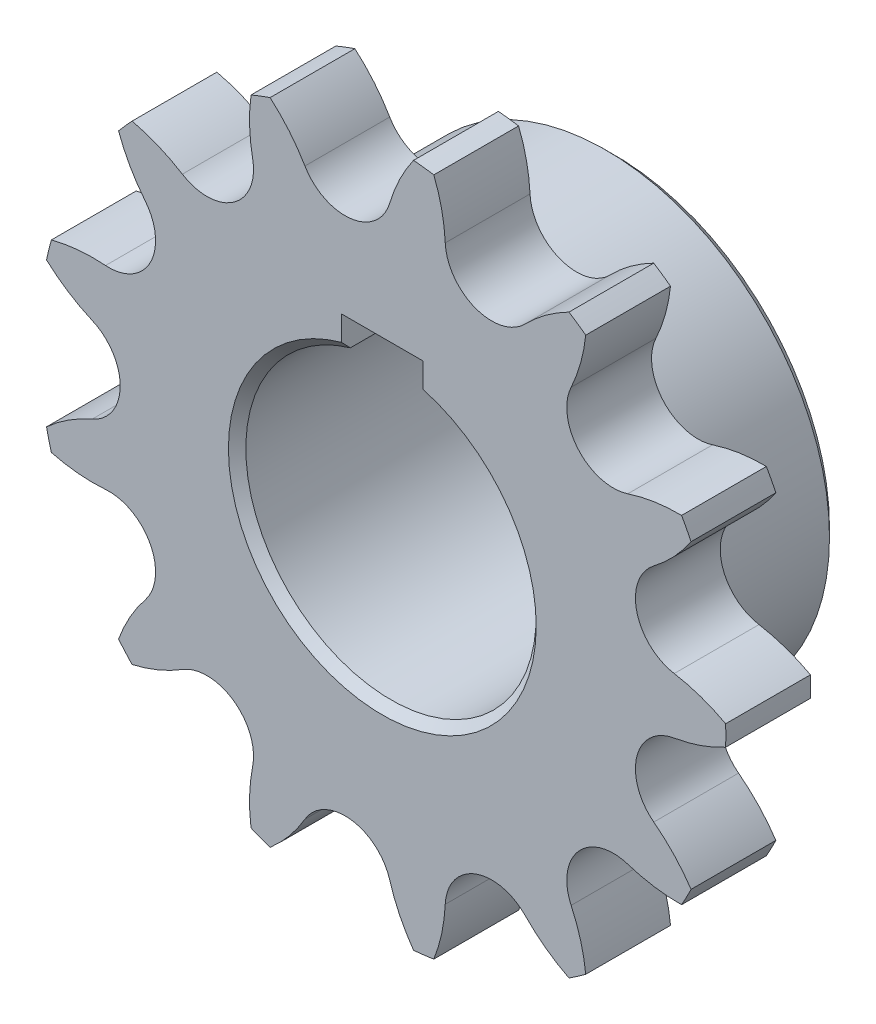
from build123d import *

# Parameters (mm, degrees)
SKETCH2_R           = 25
BOSS_EXTRUDE1_DEPTH = 14.6
BOSS_EXTRUDE2_START = -40
SKETCH3_R           = 38.5
SKETCH3_R_2         = 25
BOSS_EXTRUDE2_DEPTH = 40
SKETCH4_W           = 14
SKETCH4_H           = 9
CUT_EXTRUDE1_DEPTH  = 45
MOVE_FACE1_BY       = 0.3
CHAMFER3_SIZE       = 1.5
CHAMFER4_SIZE       = 3


with BuildPart() as part:
    # Sketch2 → Boss-Extrude1 (new body)
    with BuildSketch(Plane.XY):
        with BuildLine():
            ThreePointArc((53.163386549, 25.920934205), (52.371116098, 27.486482097), (51.532756355, 29.027840461))
            ThreePointArc((51.532756355, 29.027840461), (46.843166468, 28.705871605), (42.269756881, 27.619666278))
            ThreePointArc((42.269756881, 27.619666278), (33.778781557, 29.925389145), (32.513343984, 38.632379879))
            ThreePointArc((32.513343984, 38.632379879), (34.14289326, 43.041516576), (35.027782197, 47.658105016))
            ThreePointArc((35.027782197, 47.658105016), (33.598715171, 48.676142393), (32.140079536, 49.651342246))
            ThreePointArc((32.140079536, 49.651342246), (28.137280301, 47.186891894), (24.59251201, 44.099735432))
            ThreePointArc((24.59251201, 44.099735432), (16.002603901, 42.195398652), (10.835774224, 49.316977899))
            ThreePointArc((10.835774224, 49.316977899), (10.229640458, 53.978363864), (8.867735075, 58.47737831))
            ThreePointArc((8.867735075, 58.47737831), (7.129253506, 58.714685078), (5.384497826, 58.900319885))
            ThreePointArc((5.384497826, 58.900319885), (2.985482308, 54.857963913), (1.281419009, 50.477086658))
            ThreePointArc((1.281419009, 50.477086658), (-5.439577457, 44.798950837), (-13.324140826, 48.703650616))
            ThreePointArc((-13.324140826, 48.703650616), (-16.027099693, 52.549418501), (-19.323803285, 55.900188962))
            ThreePointArc((-19.323803285, 55.900188962), (-20.973434219, 55.302401001), (-22.604607447, 54.655944065))
            ThreePointArc((-22.604607447, 54.655944065), (-22.850253703, 49.96173751), (-22.323231644, 45.290745645))
            ThreePointArc((-22.323231644, 45.290745645), (-25.635617173, 37.139603271), (-34.431655785, 36.93290392))
            ThreePointArc((-34.431655785, 36.93290392), (-38.612224452, 39.082034648), (-43.08849119, 40.516939993))
            ThreePointArc((-43.08849119, 40.516939993), (-44.271360923, 39.22100332), (-45.415269568, 37.890550135))
            ThreePointArc((-45.415269568, 37.890550135), (-43.451271965, 33.619879148), (-40.813898952, 29.728840617))
            ThreePointArc((-40.813898952, 29.728840617), (-39.958845938, 20.972020177), (-47.651293351, 16.701274026))
            ThreePointArc((-47.651293351, 16.701274026), (-52.351753916, 16.661427647), (-56.982125035, 15.851748354))
            ThreePointArc((-56.982125035, 15.851748354), (-57.427252367, 14.154546443), (-57.821840745, 12.444887799))
            ThreePointArc((-57.821840745, 12.444887799), (-54.098127465, 9.576111636), (-49.95459387, 7.356416476))
            ThreePointArc((-49.95459387, 7.356416476), (-45.127984655, 0), (-49.95459387, -7.356416476))
            ThreePointArc((-49.95459387, -7.356416476), (-54.098127465, -9.576111636), (-57.821840745, -12.444887799))
            ThreePointArc((-57.821840745, -12.444887799), (-57.427252367, -14.154546443), (-56.982125035, -15.851748354))
            ThreePointArc((-56.982125035, -15.851748354), (-52.351753916, -16.661427647), (-47.651293351, -16.701274026))
            ThreePointArc((-47.651293351, -16.701274026), (-39.958845938, -20.972020177), (-40.813898952, -29.728840617))
            ThreePointArc((-40.813898952, -29.728840617), (-43.451271965, -33.619879148), (-45.415269568, -37.890550135))
            ThreePointArc((-45.415269568, -37.890550135), (-44.271360923, -39.22100332), (-43.08849119, -40.516939993))
            ThreePointArc((-43.08849119, -40.516939993), (-38.612224452, -39.082034648), (-34.431655785, -36.93290392))
            ThreePointArc((-34.431655785, -36.93290392), (-25.635617173, -37.139603271), (-22.323231644, -45.290745645))
            ThreePointArc((-22.323231644, -45.290745645), (-22.850253703, -49.96173751), (-22.604607446, -54.655944065))
            ThreePointArc((-22.604607446, -54.655944065), (-20.973434219, -55.302401001), (-19.323803285, -55.900188962))
            ThreePointArc((-19.323803285, -55.900188962), (-16.027099693, -52.549418501), (-13.324140826, -48.703650616))
            ThreePointArc((-13.324140826, -48.703650616), (-5.439577457, -44.798950837), (1.281419009, -50.477086658))
            ThreePointArc((1.281419009, -50.477086658), (2.985482308, -54.857963913), (5.384497826, -58.900319885))
            ThreePointArc((5.384497826, -58.900319885), (7.129253506, -58.714685078), (8.867735075, -58.47737831))
            ThreePointArc((8.867735075, -58.47737831), (10.229640457, -53.978363864), (10.835774224, -49.316977899))
            ThreePointArc((10.835774224, -49.316977899), (16.002603901, -42.195398652), (24.59251201, -44.099735432))
            ThreePointArc((24.59251201, -44.099735432), (28.137280301, -47.186891894), (32.140079536, -49.651342246))
            ThreePointArc((32.140079536, -49.651342246), (33.598715171, -48.676142393), (35.027782197, -47.658105016))
            ThreePointArc((35.027782197, -47.658105016), (34.14289326, -43.041516576), (32.513343984, -38.632379879))
            ThreePointArc((32.513343984, -38.632379879), (33.778781557, -29.925389145), (42.269756881, -27.619666278))
            ThreePointArc((42.269756881, -27.619666278), (46.843166468, -28.705871605), (51.532756355, -29.027840461))
            ThreePointArc((51.532756355, -29.027840461), (52.371116098, -27.486482097), (53.163386549, -25.920934206))
            ThreePointArc((53.163386549, -25.920934206), (50.234420683, -22.244376547), (46.742498465, -19.097569199))
            ThreePointArc((46.742498465, -19.097569199), (43.816647437, -10.799833626), (50.263509857, -4.812264433))
            ThreePointArc((50.263509857, -4.812264433), (54.817847718, -3.648682075), (59.11989973, -1.754410251))
            ThreePointArc((59.11989973, -1.754410251), (59.145925468, 0), (59.11989973, 1.754410251))
            ThreePointArc((59.11989973, 1.754410251), (54.817847718, 3.648682075), (50.263509857, 4.812264433))
            ThreePointArc((50.263509857, 4.812264433), (43.816647437, 10.799833626), (46.742498465, 19.097569199))
            ThreePointArc((46.742498465, 19.097569199), (50.234420683, 22.244376547), (53.163386549, 25.920934205))
        make_face()
        Circle(SKETCH2_R, mode=Mode.SUBTRACT)
    extrude(amount=BOSS_EXTRUDE1_DEPTH)

    # Sketch3 → Boss-Extrude2 (add)
    with BuildSketch(Plane.XY.offset(14.6).offset(BOSS_EXTRUDE2_START)):
        Circle(SKETCH3_R)
        Circle(SKETCH3_R_2, mode=Mode.SUBTRACT)
    extrude(amount=BOSS_EXTRUDE2_DEPTH)

    # Sketch4 → Cut-Extrude1 (cut)
    with BuildSketch(Plane.XY.offset(14.6)):
        with Locations((0, 25)):
            Rectangle(SKETCH4_W, SKETCH4_H)
    extrude(amount=-CUT_EXTRUDE1_DEPTH, mode=Mode.SUBTRACT)

    # Move Face1: a face moved inward by 0.3
    extrude(part.faces().sort_by_distance((0, 29.5, -5.4))[0], amount=MOVE_FACE1_BY, dir=(0, 1, 0), mode=Mode.SUBTRACT)

    # Chamfer3
    chamfer3_edges = [part.edges().sort_by_distance(p)[0] for p in [
        (-38.5, 0, -25.4),
        (0, -25, -25.4),
        (0, -25, 14.6),
    ]]
    chamfer(chamfer3_edges, length=CHAMFER3_SIZE)

    # Chamfer4
    chamfer4_edges = [part.edges().sort_by_distance(p)[0] for p in [
        (-38.5, 0, 0),
    ]]
    chamfer(chamfer4_edges, length=CHAMFER4_SIZE)


solid = part.part
